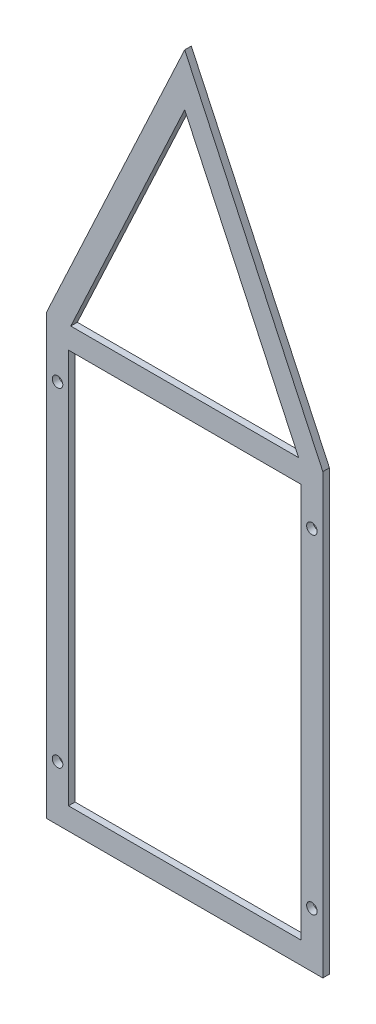
from build123d import *

# Parameters (mm, degrees)
SKETCH1_W                            = 126
SKETCH1_H                            = 200
SKETCH1_W_2                          = 106
SKETCH1_H_2                          = 180
RECTANGLE_RIB_DEPTH                  = 1.5
TRIANGLE_RIB_DEPTH                   = 3
M4_CLEARANCE_HOLE1_D                 = 4.8
MIRROR1_AT_THE_SECOND_PLANE_COPY_1_D = 4.8


with BuildPart() as part:
    # Sketch1 → Rectangle Rib (new, symmetric)
    with BuildSketch(Plane.XY):
        Rectangle(SKETCH1_W, SKETCH1_H)
        Rectangle(SKETCH1_W_2, SKETCH1_H_2, mode=Mode.SUBTRACT)
    extrude(amount=RECTANGLE_RIB_DEPTH, both=True)

    # Sketch2 → Triangle Rib (add)
    with BuildSketch(Plane.XY.offset(1.5)):
        Polygon((-63, 100), (0, 235.103935992), (63, 100), (51.96622081, 100), (0, 211.441920161), (-51.96622081, 100), align=None)
    extrude(amount=-TRIANGLE_RIB_DEPTH)

    # M4 Clearance Hole1 (through all)
    with Locations(Plane.XY.offset(1.5)):
        with Locations((-58, 75)):
            m4_clearance_hole1 = Hole(M4_CLEARANCE_HOLE1_D / 2)

    # Mirror1: M4 Clearance Hole1 across plane
    add(m4_clearance_hole1.mirror(Plane.ZX), mode=Mode.SUBTRACT)

    # Mirror1 at the second plane: M4 Clearance Hole1 across plane
    add(m4_clearance_hole1.mirror(Plane(origin=(0, 0, 0), x_dir=(0, 0, 1), z_dir=(1, 0, 0))), mode=Mode.SUBTRACT)

    # Mirror1 at the second plane copy 1 (through all)
    with Locations(Plane(origin=(0, 0, 1.5), x_dir=(-1, 0, 0), z_dir=(0, 0, 1))):
        with Locations((-58, 75)):
            Hole(MIRROR1_AT_THE_SECOND_PLANE_COPY_1_D / 2)


solid = part.part
